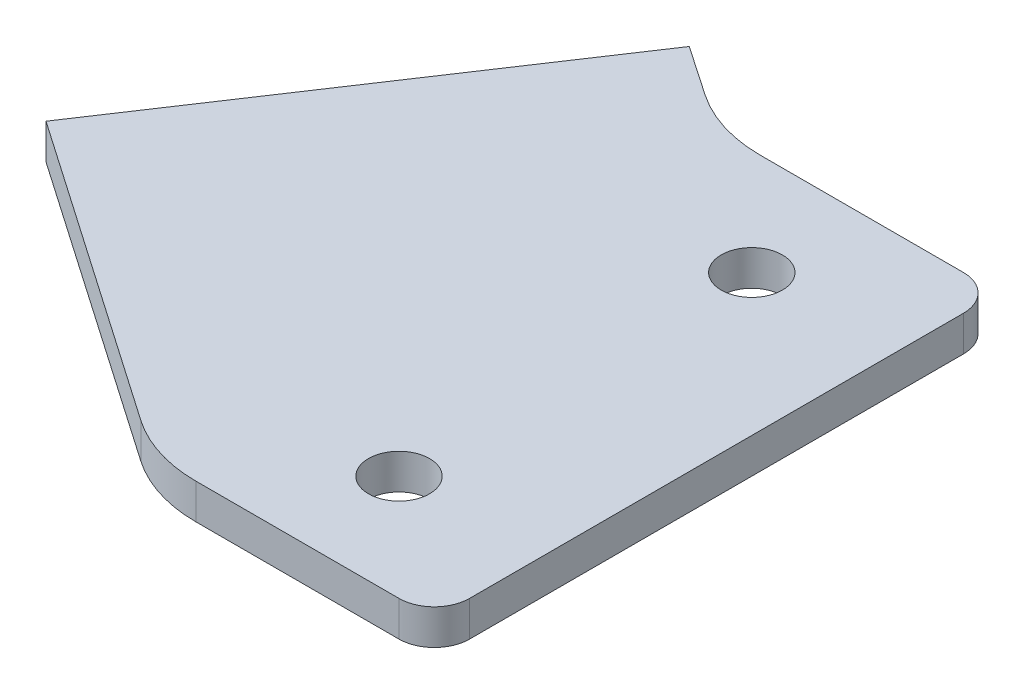
from build123d import *

# Parameters (mm, degrees)
SKETCH1_W                = 25.4
SKETCH1_H                = 50.8
BOSS_EXTRUDE1_DEPTH      = 3.175
M5_CLEARANCE_HOLE1_D     = 5.5
M5_CLEARANCE_HOLE1_DEPTH = 12.7
M5_CLEARANCE_HOLE1_TIP   = 1.652366702
FILLET1_R                = 12.7
FILLET2_R                = 3.175


with BuildPart() as part:
    # Sketch1 → Boss-Extrude1 (new body)
    with BuildSketch(Plane(origin=(0, 0, 0), x_dir=(1, 0, 0), z_dir=(0, 1, 0))):
        Polygon((-12.7, 25.4), (-20.429044148, 30.6757697), (-43.552280389, -4.091606348), (-12.7, -25.4), align=None)
        Rectangle(SKETCH1_W, SKETCH1_H)
    extrude(amount=BOSS_EXTRUDE1_DEPTH)

    # M5 Clearance Hole1
    with Locations(Plane(origin=(0, 0, 0), x_dir=(-1, 0, 0), z_dir=(0, -1, 0))):
        with Locations((0, 15.875), (0, -15.875)):
            Hole(M5_CLEARANCE_HOLE1_D / 2, depth=M5_CLEARANCE_HOLE1_DEPTH)
            with Locations((0, 0, -(M5_CLEARANCE_HOLE1_DEPTH + M5_CLEARANCE_HOLE1_TIP / 2))):  # 118° drill point
                Cone(0, M5_CLEARANCE_HOLE1_D / 2, M5_CLEARANCE_HOLE1_TIP, mode=Mode.SUBTRACT)

    # Fillet1
    fillet1_edges = [part.edges().sort_by_distance(p)[0] for p in [
        (-12.7, 1.5875, -25.4),
        (-12.7, 1.5875, 25.4),
    ]]
    fillet(fillet1_edges, radius=FILLET1_R)

    # Fillet2
    fillet2_edges = [part.edges().sort_by_distance(p)[0] for p in [
        (12.7, 1.5875, -25.4),
        (12.7, 1.5875, 25.4),
    ]]
    fillet(fillet2_edges, radius=FILLET2_R)


solid = part.part
